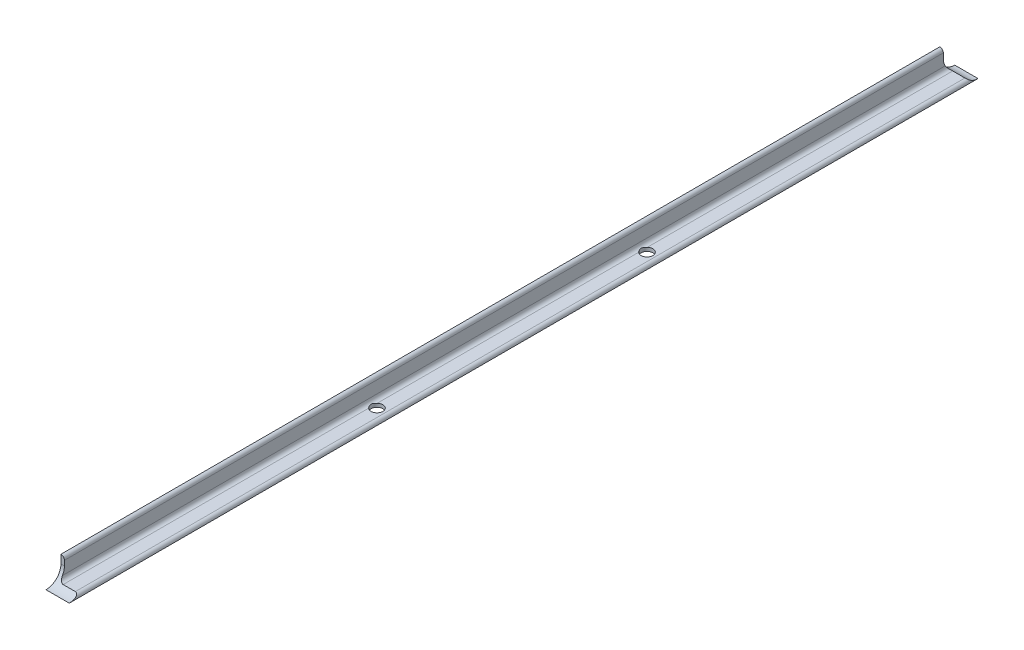
from build123d import *

# Parameters (mm, degrees)
MIEMBRO_ESTRUCTURAL1_DEPTH    = 780.7
CORTAR_EXTRUIR2_DEPTH         = 600.996074077
TALADRO_DE_MARGEN_PARA_3_81_D = 10.0838


with BuildPart() as part:
    # Sketch1 → Miembro estructural1 (new body)
    with BuildSketch(Plane.XY.offset(-599.329032258)):
        with BuildLine():
            Line((0, 0), (0, 20))
            ThreePointArc((0, 20), (2.121320344, 19.121320344), (3, 17))
            Line((3, 17), (3, 6.5))
            ThreePointArc((3, 6.5), (4.025126266, 4.025126266), (6.5, 3))
            Line((6.5, 3), (17, 3))
            ThreePointArc((17, 3), (19.121320344, 2.121320344), (20, 0))
            Line((20, 0), (0, 0))
        make_face()
    extrude(amount=MIEMBRO_ESTRUCTURAL1_DEPTH)

    # Croquis2 → Cortar-Extruir2 (cut, through all)
    with BuildSketch(Plane.YZ):
        with BuildLine():
            Line((20, 181.370967742), (0, 181.370967742))
            ThreePointArc((0, 181.370967742), (3.743979256, 172.325057712), (12.785701293, 168.570975728))
            Line((12.785701293, 168.570975728), (20, 168.570975728))
            Line((20, 168.570975728), (20, 181.370967742))
        make_face()
        with BuildLine():
            ThreePointArc((12.785701293, -586.529040245), (3.743979256, -590.283122228), (0, -599.329032258))
            Line((0, -599.329032258), (20, -599.329032258))
            Line((20, -599.329032258), (20, -586.529040245))
            Line((20, -586.529040245), (12.785701293, -586.529040245))
        make_face()
    extrude(amount=CORTAR_EXTRUIR2_DEPTH, mode=Mode.SUBTRACT)

    # Taladro de margen para 3/81 (through all)
    with Locations(Plane(origin=(0, 0, 0), x_dir=(-1, 0, 0), z_dir=(0, -1, 0))):
        with Locations((-10, 92.979032258), (-10, 324.979032258)):
            Hole(TALADRO_DE_MARGEN_PARA_3_81_D / 2)


solid = part.part
